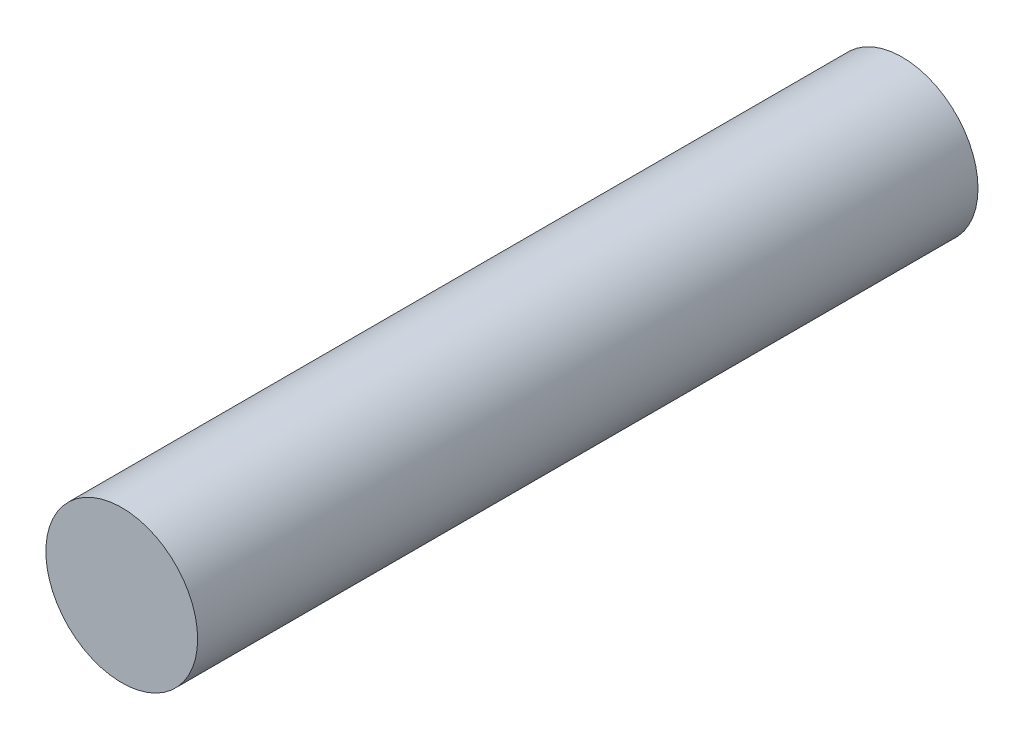
from build123d import *

# Parameters (mm, degrees)
ESQUISSE2_R        = 49.403
BOSS_EXTRU_1_DEPTH = 508


with BuildPart() as part:
    # Esquisse2 → Boss.-Extru.1 (new body)
    with BuildSketch(Plane.XY):
        Circle(ESQUISSE2_R)
    extrude(amount=BOSS_EXTRU_1_DEPTH)


solid = part.part
